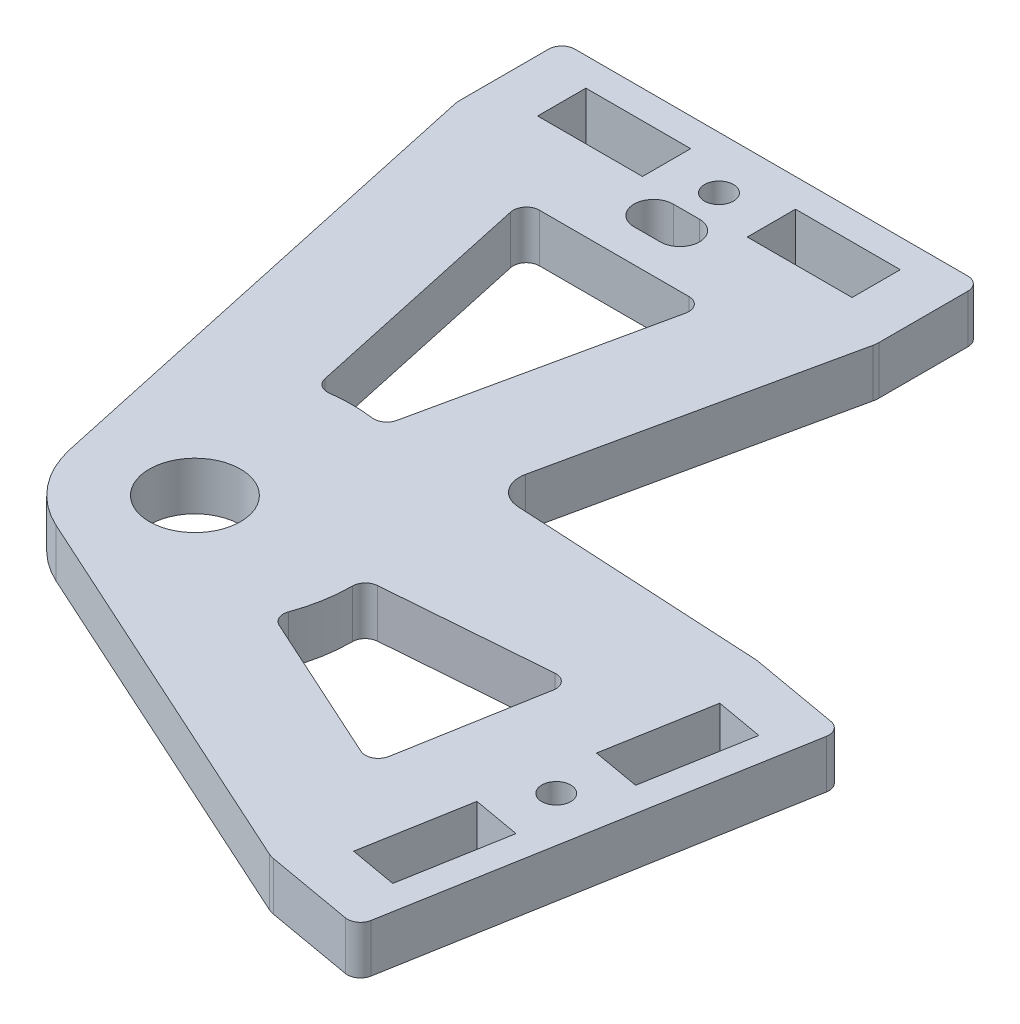
from build123d import *

# Parameters (mm, degrees)
SKETCH1_R           = 5.5245
SKETCH1_R_2         = 1.7526
SKETCH1_W           = 12.7
SKETCH1_H           = 5.842
BOSS_EXTRUDE1_DEPTH = 5.842
FILLET1_R           = 1.5875
FILLET2_R           = 1.5875
FILLET3_R           = 3.175
CUT_EXTRUDE3_DEPTH  = 95.62556025


with BuildPart() as part:
    # Sketch1 → Boss-Extrude1 (new body)
    with BuildSketch(Plane(origin=(0, 0, 0), x_dir=(1, 0, 0), z_dir=(0, 1, 0))):
        with BuildLine():
            Line((-25.4, 57.15), (-12.411023526, -2.693788234))
            ThreePointArc((-12.411023526, -2.693788234), (-9.884908198, -7.97361837), (-5.259246403, -11.559858445))
            Line((-5.259246403, -11.559858445), (42.490805524, -33.284111388))
            Line((42.490805524, -33.284111388), (54.997863988, -35.489443244))
            Line((54.997863988, -35.489443244), (63.819191413, 14.538790609))
            Line((63.819191413, 14.538790609), (51.31213295, 16.744122465))
            Line((51.31213295, 16.744122465), (17.03122895, 18.5927693))
            Line((17.03122895, 18.5927693), (25.4, 57.15))
            Line((25.4, 57.15), (25.4, 69.85))
            Line((25.4, 69.85), (-25.4, 69.85))
            Line((-25.4, 69.85), (-25.4, 57.15))
        make_face()
        with Locations(Location((0, 0, 0), (0, 0, 270))):
            Circle(SKETCH1_R, mode=Mode.SUBTRACT)
        with Locations(Location((0, 63.5, 0), (0, 0, 270))):
            Circle(SKETCH1_R_2, mode=Mode.SUBTRACT)
        with Locations(Location((53.154998469, -9.37266039, 0), (0, 0, 270))):
            Circle(SKETCH1_R_2, mode=Mode.SUBTRACT)
        with Locations((-12.7, 63.5)):
            Rectangle(SKETCH1_W, SKETCH1_H, mode=Mode.SUBTRACT)
        with Locations((12.7, 63.5)):
            Rectangle(SKETCH1_W, SKETCH1_H, mode=Mode.SUBTRACT)
        Polygon((53.603383206, 9.991624401), (51.364030551, -2.708375599), (57.117277444, -3.722828253), (59.356630099, 8.977171747), align=None, mode=Mode.SUBTRACT)
        Polygon((52.706613732, -28.73694518), (54.945966387, -16.03694518), (49.192719493, -15.022492526), (46.953366838, -27.722492526), align=None, mode=Mode.SUBTRACT)
        with BuildLine():
            Line((-4.04068235, 18.616535288), (-11.026040035, 50.8))
            Line((-11.026040035, 50.8), (11.026040035, 50.8))
            Line((11.026040035, 50.8), (4.04068235, 18.616535288))
            ThreePointArc((4.04068235, 18.616535288), (0, 19.05), (-4.04068235, 18.616535288))
        make_face(mode=Mode.SUBTRACT)
        with BuildLine():
            Line((17.339787668, -7.888869605), (38.799209797, -17.651998555))
            Line((38.799209797, -17.651998555), (42.496670214, 3.317341488))
            Line((42.496670214, 3.317341488), (18.99222283, 1.48255589))
            ThreePointArc((18.99222283, 1.48255589), (18.760587695, -3.307997785), (17.339787668, -7.888869605))
        make_face(mode=Mode.SUBTRACT)
    extrude(amount=BOSS_EXTRUDE1_DEPTH)

    # Fillet1
    fillet1_edges = [part.edges().sort_by_distance(p)[0] for p in [
        (18.99222283, 2.921, -1.48255589),
        (17.339787668, 2.921, 7.888869605),
        (38.799209797, 2.921, 17.651998555),
        (42.496670214, 2.921, -3.317341488),
        (-4.04068235, 2.921, -18.616535288),
        (4.04068235, 2.921, -18.616535288),
        (11.026040035, 2.921, -50.8),
        (-11.026040035, 2.921, -50.8),
    ]]
    fillet(fillet1_edges, radius=FILLET1_R)

    # Fillet2
    fillet2_edges = [part.edges().sort_by_distance(p)[0] for p in [
        (-25.4, 2.921, -69.85),
        (25.4, 2.921, -69.85),
        (63.819191413, 2.921, -14.538790609),
        (54.997863988, 2.921, 35.489443244),
    ]]
    fillet(fillet2_edges, radius=FILLET2_R)

    # Fillet3
    fillet3_edges = [part.edges().sort_by_distance(p)[0] for p in [
        (25.4, 2.921, -57.15),
        (17.03122895, 2.921, -18.5927693),
        (51.31213295, 2.921, -16.744122465),
        (42.490805524, 2.921, 33.284111388),
        (-25.4, 2.921, -57.15),
    ]]
    fillet(fillet3_edges, radius=FILLET3_R)

    # Sketch2 → Cut-Extrude3 (cut, through all)
    with BuildSketch(Plane(origin=(0, 5.842, 0), x_dir=(1, 0, 0), z_dir=(0, 1, 0))):
        with BuildLine():
            Line((1.5875, 54.791775853), (-1.5875, 54.791775853))
            ThreePointArc((-1.5875, 54.791775853), (-3.96875, 57.173025853), (-1.5875, 59.554275853))
            Line((-1.5875, 59.554275853), (1.5875, 59.554275853))
            ThreePointArc((1.5875, 59.554275853), (3.96875, 57.173025853), (1.5875, 54.791775853))
        make_face()
    extrude(amount=-CUT_EXTRUDE3_DEPTH, mode=Mode.SUBTRACT)


solid = part.part
